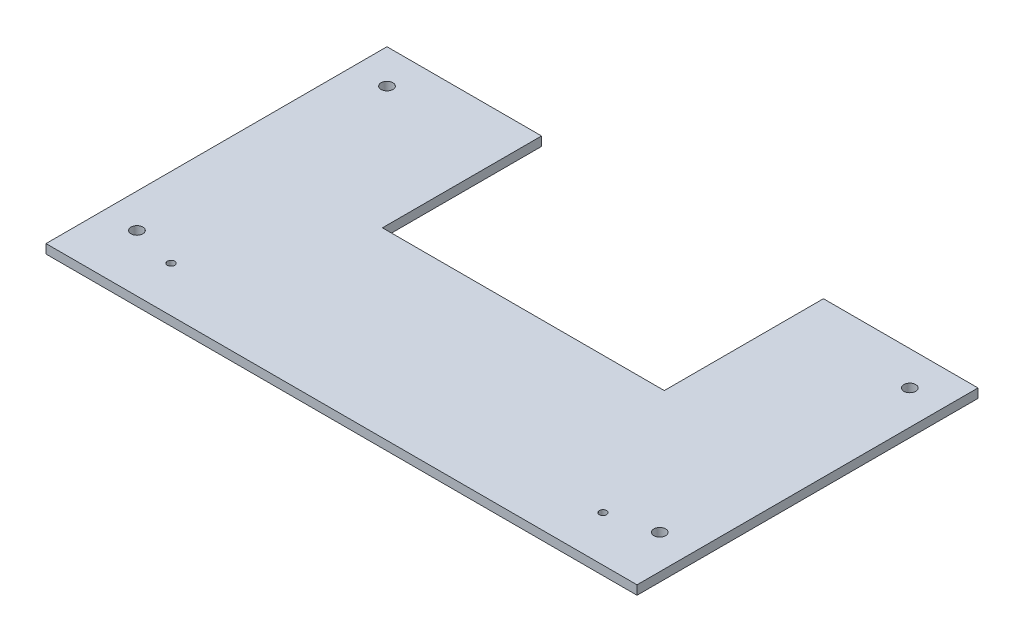
from build123d import *

# Parameters (mm, degrees)
CROQUIS1_W              = 260
CROQUIS1_H              = 150
SALIENTE_EXTRUIR1_DEPTH = 4
CROQUIS2_R              = 1.6
CROQUIS2_W              = 124
CROQUIS2_H              = 70
CORTAR_EXTRUIR1_DEPTH   = 4
CROQUIS3_R              = 2.6
CORTAR_EXTRUIR2_DEPTH   = 4


with BuildPart() as part:
    # Croquis1 → Saliente-Extruir1 (new body)
    with BuildSketch(Plane(origin=(0, 0, 0), x_dir=(1, 0, 0), z_dir=(0, 1, 0))):
        Rectangle(CROQUIS1_W, CROQUIS1_H)
    extrude(amount=SALIENTE_EXTRUIR1_DEPTH)

    # Croquis2 → Cortar-Extruir1 (cut)
    with BuildSketch(Plane(origin=(0, 4, 0), x_dir=(1, 0, 0), z_dir=(0, 1, 0))):
        with Locations(Location((95, -55, 0), (0, 0, 270))):
            Circle(CROQUIS2_R)
        with Locations(Location((-95, -55, 0), (0, 0, 270))):
            Circle(CROQUIS2_R)
        with Locations((0, 40)):
            Rectangle(CROQUIS2_W, CROQUIS2_H)
    extrude(amount=-CORTAR_EXTRUIR1_DEPTH, mode=Mode.SUBTRACT)

    # Croquis3 → Cortar-Extruir2 (cut)
    with BuildSketch(Plane(origin=(0, 4, 0), x_dir=(1, 0, 0), z_dir=(0, 1, 0))):
        with Locations(Location((-115, 60, 0), (0, 0, 270))):
            Circle(CROQUIS3_R)
        with Locations(Location((115, 60, 0), (0, 0, 270))):
            Circle(CROQUIS3_R)
        with Locations(Location((115, -50, 0), (0, 0, 270))):
            Circle(CROQUIS3_R)
        with Locations(Location((-115, -50, 0), (0, 0, 270))):
            Circle(CROQUIS3_R)
    extrude(amount=-CORTAR_EXTRUIR2_DEPTH, mode=Mode.SUBTRACT)


solid = part.part
